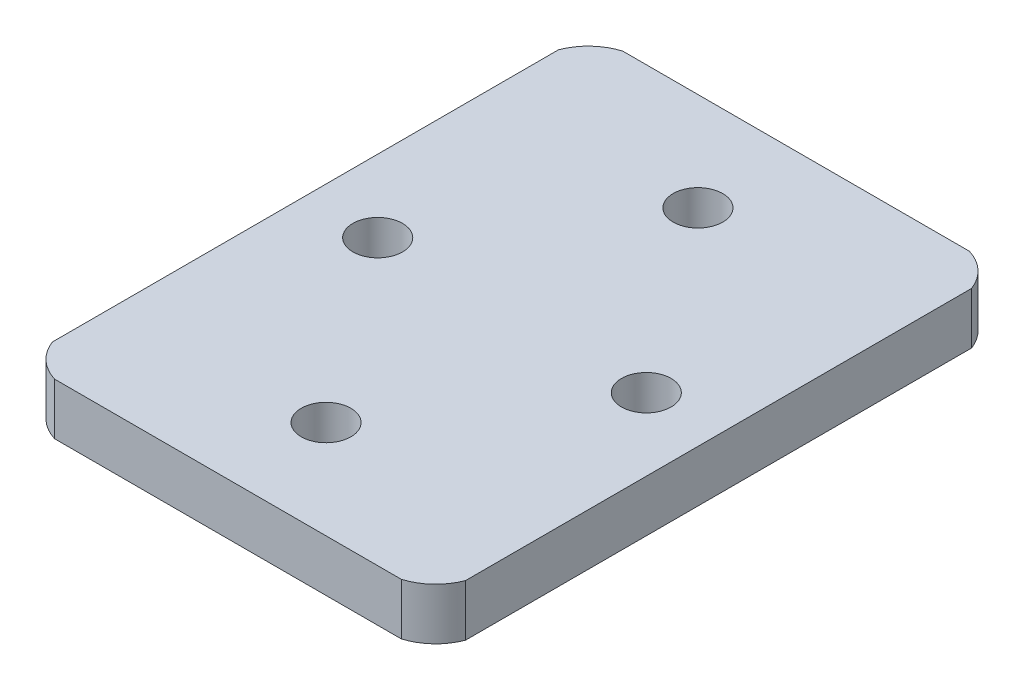
from build123d import *

# Parameters (mm, degrees)
SKETCH1_R           = 2.4
BOSS_EXTRUDE1_DEPTH = 5


with BuildPart() as part:
    # Sketch1 → Boss-Extrude1 (new body)
    with BuildSketch(Plane(origin=(0, 0, 0), x_dir=(1, 0, 0), z_dir=(0, 1, 0))):
        with BuildLine():
            Line((-16.782005905, 33.012637592), (16.782005905, 33.012637592))
            ThreePointArc((16.782005905, 33.012637592), (18.738692672, 31.885592081), (20, 30.012637592))
            Line((20, 30.012637592), (20, -18.987362408))
            ThreePointArc((20, -18.987362408), (18.738692672, -20.860316896), (16.782005905, -21.987362408))
            Line((16.782005905, -21.987362408), (-16.782005905, -21.987362408))
            ThreePointArc((-16.782005905, -21.987362408), (-18.738692672, -20.860316896), (-20, -18.987362408))
            Line((-20, -18.987362408), (-20, 30.012637592))
            ThreePointArc((-20, 30.012637592), (-18.738692672, 31.885592081), (-16.782005905, 33.012637592))
        make_face()
        with Locations(Location((0, 23.512637592, 0), (0, 0, 270))):
            Circle(SKETCH1_R, mode=Mode.SUBTRACT)
        with Locations(Location((-13, 5.512637592, 0), (0, 0, 270))):
            Circle(SKETCH1_R, mode=Mode.SUBTRACT)
        with Locations(Location((0, -12.487362408, 0), (0, 0, 90))):
            Circle(SKETCH1_R, mode=Mode.SUBTRACT)
        with Locations(Location((13, 5.512637592, 0), (0, 0, 90))):
            Circle(SKETCH1_R, mode=Mode.SUBTRACT)
    extrude(amount=BOSS_EXTRUDE1_DEPTH)


solid = part.part
